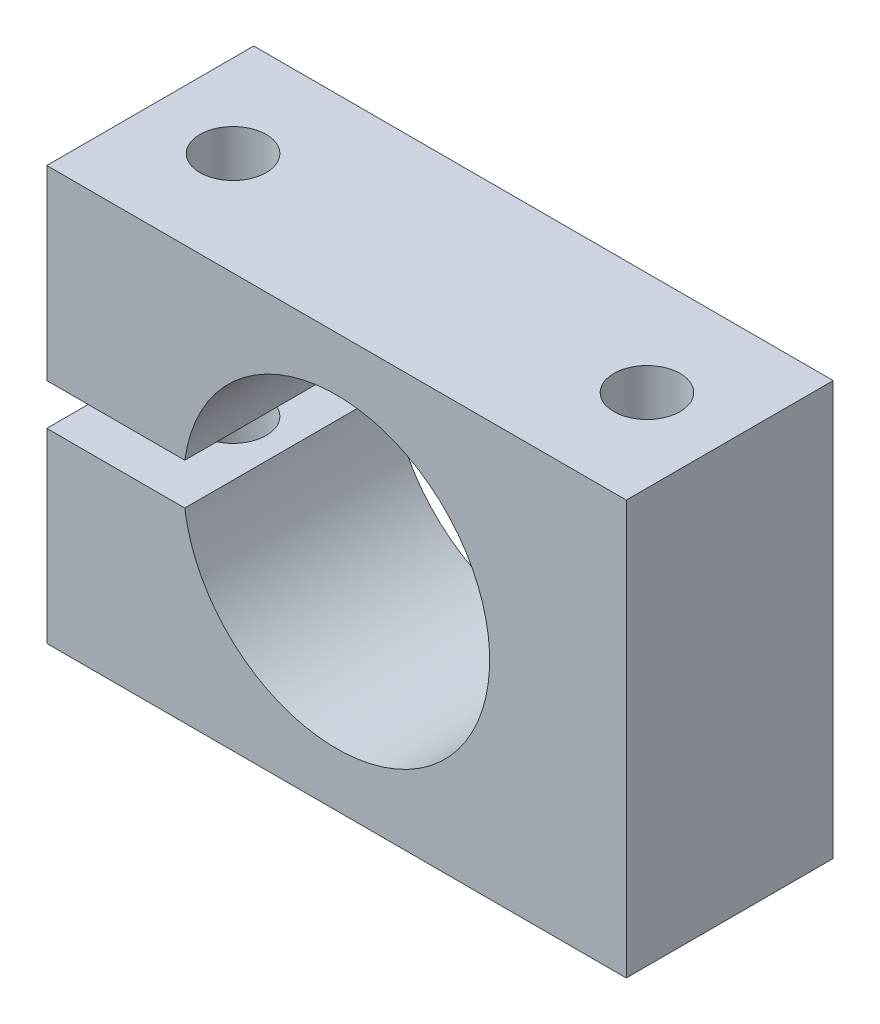
from build123d import *

# Parameters (mm, degrees)
SKIZZE1_W                       = 70
SKIZZE1_H                       = 25
AUFSATZ_LINEAR_AUSTRAGEN1_DEPTH = 50
SCHNITT_LINEAR_AUSTRAGEN1_DEPTH = 50
SKIZZE3_R                       = 4
SCHNITT_LINEAR_AUSTRAGEN2_DEPTH = 63.299678972


with BuildPart() as part:
    # Skizze1 → Aufsatz-Linear austragen1 (new body)
    with BuildSketch(Plane(origin=(0, 0, 0), x_dir=(1, 0, 0), z_dir=(0, 1, 0))):
        Rectangle(SKIZZE1_W, SKIZZE1_H)
    extrude(amount=AUFSATZ_LINEAR_AUSTRAGEN1_DEPTH)

    # Skizze2 → Schnitt-Linear austragen1 (cut)
    with BuildSketch(Plane.XY.offset(12.5)):
        with BuildLine():
            ThreePointArc((18.5, 25), (1.252876405, 43.457526939), (-18.33030278, 27.5))
            Line((-18.33030278, 27.5), (0, 27.5))
            Line((0, 27.5), (0, 22.5))
            Line((0, 22.5), (-18.33030278, 22.5))
            ThreePointArc((-18.33030278, 22.5), (1.252876405, 6.542473061), (18.5, 25))
        make_face()
        with BuildLine():
            Line((0, 27.5), (-18.33030278, 27.5))
            ThreePointArc((-18.33030278, 27.5), (-18.5, 25), (-18.33030278, 22.5))
            Line((-18.33030278, 22.5), (0, 22.5))
            Line((0, 22.5), (0, 27.5))
        make_face()
        with BuildLine():
            Line((-18.33030278, 27.5), (-35, 27.5))
            Line((-35, 27.5), (-35, 22.5))
            Line((-35, 22.5), (-18.33030278, 22.5))
            ThreePointArc((-18.33030278, 22.5), (-18.5, 25), (-18.33030278, 27.5))
        make_face()
    extrude(amount=-SCHNITT_LINEAR_AUSTRAGEN1_DEPTH, mode=Mode.SUBTRACT)

    # Skizze3 → Schnitt-Linear austragen2 (cut, through all)
    with BuildSketch(Plane.XZ):
        with Locations(Location((-25, 0, 0), (0, 0, 270))):
            Circle(SKIZZE3_R)
        with Locations(Location((25, 0, 0), (0, 0, 270))):
            Circle(SKIZZE3_R)
    extrude(amount=-SCHNITT_LINEAR_AUSTRAGEN2_DEPTH, mode=Mode.SUBTRACT)


solid = part.part
